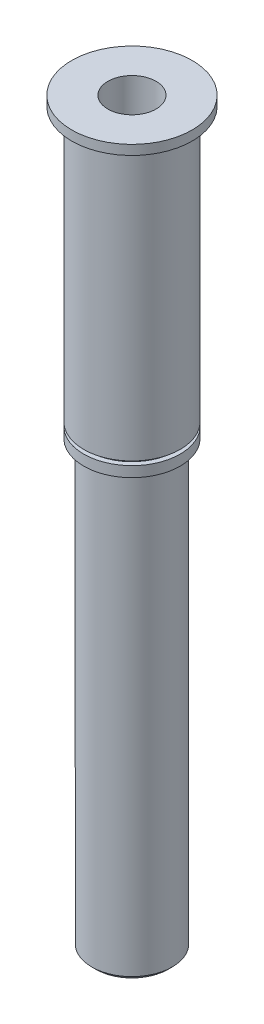
from build123d import *

# Parameters (mm, degrees)
CHAMFER1_SIZE         = 0.5
BOSS_EXTRUDE1_START   = -1.2
SKETCH2_R             = 7.5
SKETCH2_R_2           = 3
BOSS_EXTRUDE1_DEPTH   = 1.2
SKETCH5_R             = 2.5
CUT_EXTRUDE1_DEPTH    = 54.135491794
M6_TAPPED_HOLE1_D     = 5
M6_TAPPED_HOLE1_DEPTH = 17
M6_TAPPED_HOLE1_TIP   = 1.502151548


with BuildPart() as part:
    # Sketch1 → Revolve1 (revolve)
    with BuildSketch(Plane.XY, mode=Mode.PRIVATE) as revolve1_sk:
        Polygon((-3, 39.933883493), (-3, 14.933883493), (0, 14.933883493), (0, -52.066116507), (-5, -52.066116507), (-5, 2.933883493), (-6, 2.933883493), (-6, 39.933883493), align=None)
    revolve(revolve1_sk.sketch.rotate(Axis((0, 54.453238627, 0), (0, -1, 0)), 270), axis=Axis((0, 54.453238627, 0), (0, -1, 0)))

    # Chamfer1
    chamfer1_edges = [part.edges().sort_by_distance(p)[0] for p in [
        (0, -52.066116507, -5),
    ]]
    chamfer(chamfer1_edges, length=CHAMFER1_SIZE)

    # Sketch2 → Boss-Extrude1 (add)
    with BuildSketch(Plane(origin=(0, 39.933883493, 0), x_dir=(1, 0, 0), z_dir=(0, 1, 0)).offset(BOSS_EXTRUDE1_START)):
        with Locations(Location((0, 0, 0), (0, 0, 270))):
            Circle(SKETCH2_R)
        with Locations(Location((0, 0, 0), (0, 0, 270))):
            Circle(SKETCH2_R_2, mode=Mode.SUBTRACT)
    extrude(amount=BOSS_EXTRUDE1_DEPTH)

    # Sketch4 → Groove for ANSI B27.7 - 3BM1-12, Basic Internal Retaining Ring1 (revolve, cut)
    with BuildSketch(Plane(origin=(0, 54.453238627, 0), x_dir=(0, 0, 1), z_dir=(-1, 0, 0))):
        with BuildLine():
            Line((6.225, -50.219355134), (5.4, -50.219355134))
            Line((5.4, -50.219355134), (5.4, -49.719355134))
            Line((5.4, -49.719355134), (6.225, -49.719355134))
            ThreePointArc((6.225, -49.719355134), (6.295710678, -49.748644456), (6.325, -49.819355134))
            Line((6.325, -49.819355134), (6.325, -50.119355134))
            ThreePointArc((6.325, -50.119355134), (6.295710678, -50.190065812), (6.225, -50.219355134))
        make_face()
    revolve(axis=Axis((0, 4.453238627, 0), (0, 1, 0)), mode=Mode.SUBTRACT)

    # Sketch5 → Cut-Extrude1 (cut, through all)
    with BuildSketch(Plane(origin=(0, 0, 0), x_dir=(0, 0, -1), z_dir=(1, 0, 0))):
        with Locations((0, 24.933883493)):
            Circle(SKETCH5_R)
    extrude(amount=-CUT_EXTRUDE1_DEPTH, mode=Mode.SUBTRACT)

    # M6 Tapped Hole1
    with Locations(Plane.XZ.offset(52.066116507)):
        with Locations((0, 0)):
            Hole(M6_TAPPED_HOLE1_D / 2, depth=M6_TAPPED_HOLE1_DEPTH)
            with Locations((0, 0, -(M6_TAPPED_HOLE1_DEPTH + M6_TAPPED_HOLE1_TIP / 2))):  # 118° drill point
                Cone(0, M6_TAPPED_HOLE1_D / 2, M6_TAPPED_HOLE1_TIP, mode=Mode.SUBTRACT)


solid = part.part
